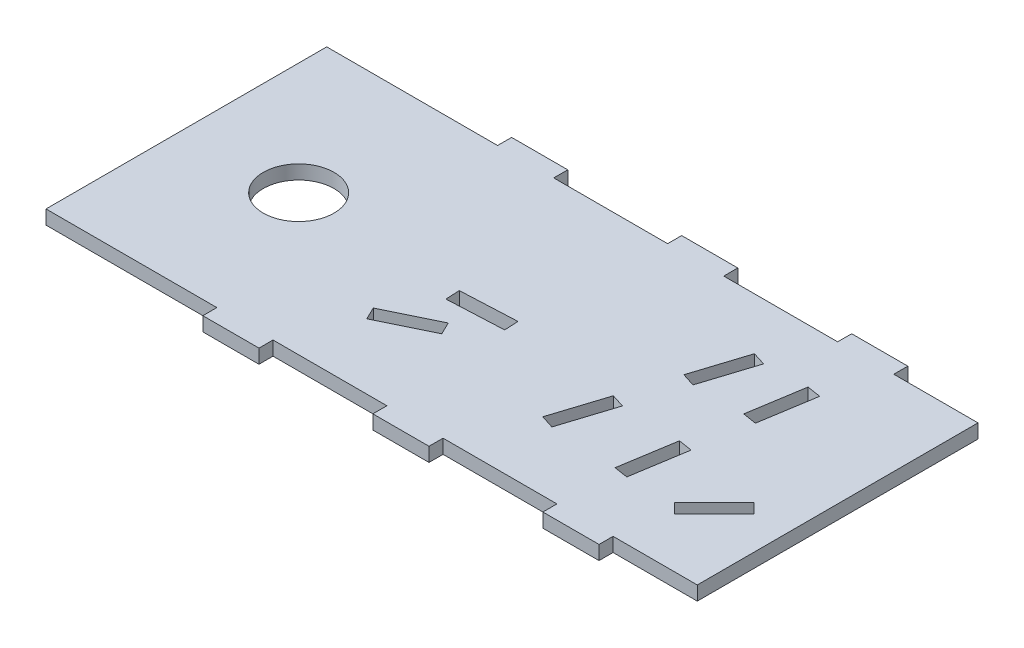
from build123d import *

# Parameters (mm, degrees)
SKETCH1_R           = 8
BOSS_EXTRUDE1_DEPTH = 3.175


with BuildPart() as part:
    # Sketch1 → Boss-Extrude1 (new body)
    with BuildSketch(Plane(origin=(0, 0, 0), x_dir=(1, 0, 0), z_dir=(0, 1, 0))):
        Polygon((128.27, 0), (128.27, -3.175), (115.57, -3.175), (115.57, 0), (89.809134643, 0), (89.809134643, -3.175), (77.109134643, -3.175), (77.109134643, 0), (51.348269287, 0), (51.348269287, -3.175), (38.648269287, -3.175), (38.648269287, 0), (0, 0), (0, 63.5), (38.648269287, 63.5), (38.648269287, 66.675), (51.348269287, 66.675), (51.348269287, 63.5), (77.109134643, 63.5), (77.109134643, 66.675), (89.809134643, 66.675), (89.809134643, 63.5), (115.57, 63.5), (115.57, 66.675), (128.27, 66.675), (128.27, 63.5), (147.32, 63.5), (147.32, 0), align=None)
        with Locations(Location((25.4, 31.75, 0), (0, 0, 270))):
            Circle(SKETCH1_R, mode=Mode.SUBTRACT)
        Polygon((124.212866127, 50.8), (122.206447374, 38.259494277), (119.071320943, 38.761098966), (121.077739696, 51.301604688), align=None, mode=Mode.SUBTRACT)
        Polygon((117.064902189, 26.220593243), (115.058483436, 13.68008752), (118.193609867, 13.178482831), (120.20002862, 25.718988554), align=None, mode=Mode.SUBTRACT)
        Polygon((111.512866127, 50.8), (107.651646253, 38.701199188), (104.62694605, 39.666504157), (108.488165924, 51.765304968), align=None, mode=Mode.SUBTRACT)
        Polygon((100.765726177, 27.567703345), (96.904506303, 15.468902533), (99.929206506, 14.503597564), (103.79042638, 26.602398376), align=None, mode=Mode.SUBTRACT)
        Polygon((139.840468497, 20.301267714), (130.860212376, 11.321011593), (128.615148346, 13.566075623), (137.595404467, 22.546331745), align=None, mode=Mode.SUBTRACT)
        Polygon((69.226557851, 20.301267714), (57.802174059, 14.753885002), (56.415328381, 17.60998095), (67.839712173, 23.157363662), align=None, mode=Mode.SUBTRACT)
        Polygon((75.576557851, 28.17210754), (62.890656439, 27.573855616), (62.741093458, 30.745330969), (75.42699487, 31.343582893), align=None, mode=Mode.SUBTRACT)
    extrude(amount=BOSS_EXTRUDE1_DEPTH)


solid = part.part
